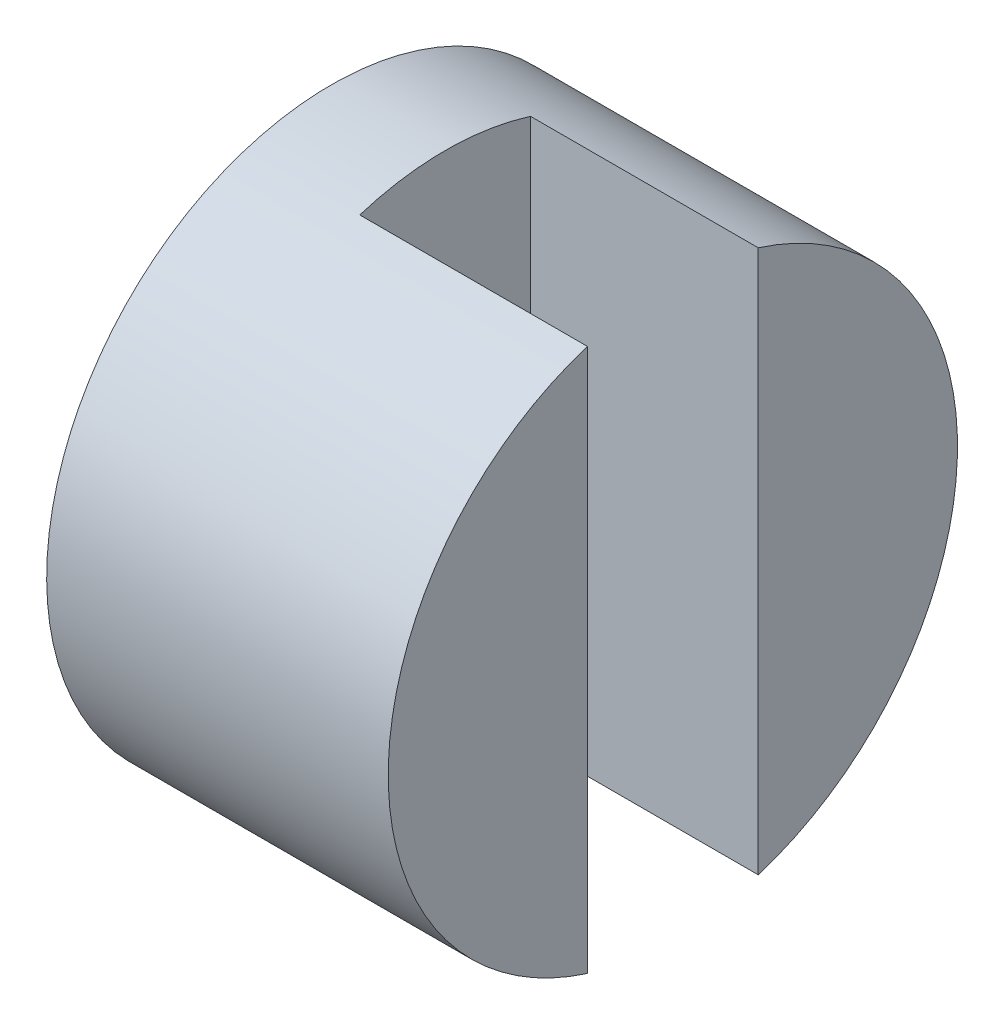
from build123d import *

# Parameters (mm, degrees)
SKETCH2_R           = 5
BOSS_EXTRUDE1_DEPTH = 6
CUT_EXTRUDE1_START  = -4
CUT_EXTRUDE1_DEPTH  = 4


with BuildPart() as part:
    # Sketch2 → Boss-Extrude1 (new body)
    with BuildSketch(Plane(origin=(0, 0, 0), x_dir=(0, 0, -1), z_dir=(1, 0, 0))):
        Circle(SKETCH2_R)
    extrude(amount=BOSS_EXTRUDE1_DEPTH)

    # Sketch3 → Cut-Extrude1 (cut)
    with BuildSketch(Plane(origin=(6, 0, 0), x_dir=(0, 0, -1), z_dir=(1, 0, 0)).offset(CUT_EXTRUDE1_START)):
        with BuildLine():
            Line((-1.5, 4.769696007), (-1.5, -4.769696007))
            ThreePointArc((-1.5, -4.769696007), (0, -5), (1.5, -4.769696007))
            Line((1.5, -4.769696007), (1.5, 4.769696007))
            ThreePointArc((1.5, 4.769696007), (0, 5), (-1.5, 4.769696007))
        make_face()
    extrude(amount=CUT_EXTRUDE1_DEPTH, mode=Mode.SUBTRACT)


solid = part.part
